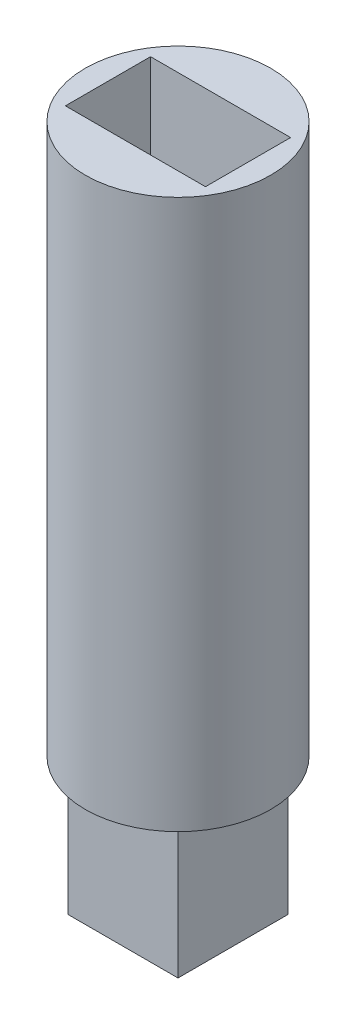
from build123d import *

# Parameters (mm, degrees)
SKETCH1_R           = 3.375
BOSS_EXTRUDE1_DEPTH = 20
SKETCH3_W           = 5.1
SKETCH3_H           = 3.1
CUT_EXTRUDE2_DEPTH  = 6
SKETCH2_W           = 4
SKETCH2_H           = 4
BOSS_EXTRUDE2_DEPTH = 5


with BuildPart() as part:
    # Sketch1 → Boss-Extrude1 (new body)
    with BuildSketch(Plane(origin=(0, 0, 0), x_dir=(1, 0, 0), z_dir=(0, 1, 0))):
        with Locations(Location((0, 0, 0), (0, 0, 270))):
            Circle(SKETCH1_R)
    extrude(amount=BOSS_EXTRUDE1_DEPTH)

    # Sketch3 → Cut-Extrude2 (cut)
    with BuildSketch(Plane(origin=(0, 20, 0), x_dir=(1, 0, 0), z_dir=(0, 1, 0))):
        Rectangle(SKETCH3_W, SKETCH3_H)
    extrude(amount=-CUT_EXTRUDE2_DEPTH, mode=Mode.SUBTRACT)

    # Sketch2 → Boss-Extrude2 (add)
    with BuildSketch(Plane(origin=(0, 0, 0), x_dir=(-1, 0, 0), z_dir=(0, -1, 0))):
        Rectangle(SKETCH2_W, SKETCH2_H)
    extrude(amount=BOSS_EXTRUDE2_DEPTH)


solid = part.part
